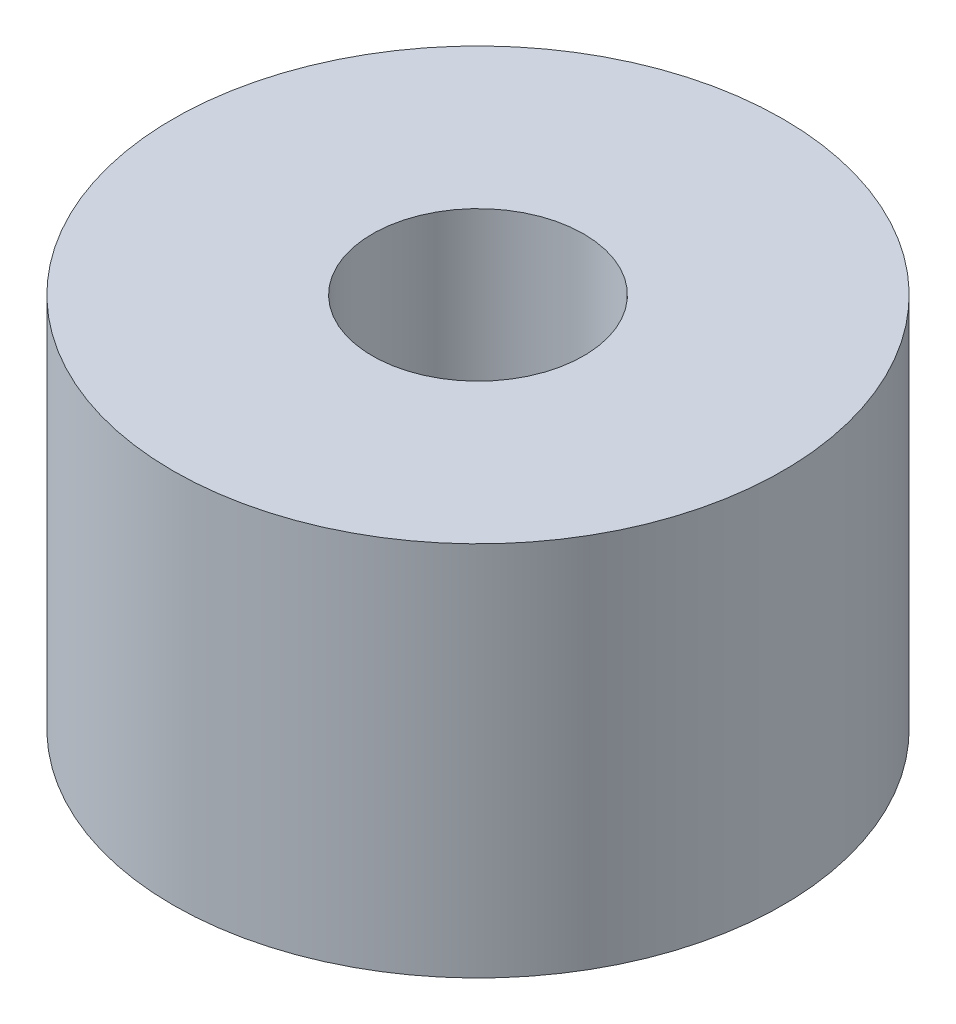
from build123d import *

# Parameters (mm, degrees)
SKETCH1_R           = 9.525
SKETCH1_R_2         = 3.302
BOSS_EXTRUDE1_DEPTH = 7.62
SKETCH2_R           = 9.525
SKETCH2_R_2         = 3.302
BOSS_EXTRUDE2_DEPTH = 4.1275


with BuildPart() as part:
    # Sketch1 → Boss-Extrude1 (new body)
    with BuildSketch(Plane(origin=(0, 0, 0), x_dir=(1, 0, 0), z_dir=(0, 1, 0))):
        with Locations(Location((0, 0, 0), (0, 0, 90))):
            Circle(SKETCH1_R)
        with Locations(Location((0, 0, 0), (0, 0, 90))):
            Circle(SKETCH1_R_2, mode=Mode.SUBTRACT)
    extrude(amount=BOSS_EXTRUDE1_DEPTH)

    # Sketch2 → Boss-Extrude2 (add)
    with BuildSketch(Plane(origin=(0, 7.62, 0), x_dir=(1, 0, 0), z_dir=(0, 1, 0))):
        with Locations(Location((0, 0, 0), (0, 0, 90))):
            Circle(SKETCH2_R)
        with Locations(Location((0, 0, 0), (0, 0, 90))):
            Circle(SKETCH2_R_2, mode=Mode.SUBTRACT)
    extrude(amount=BOSS_EXTRUDE2_DEPTH)


solid = part.part
